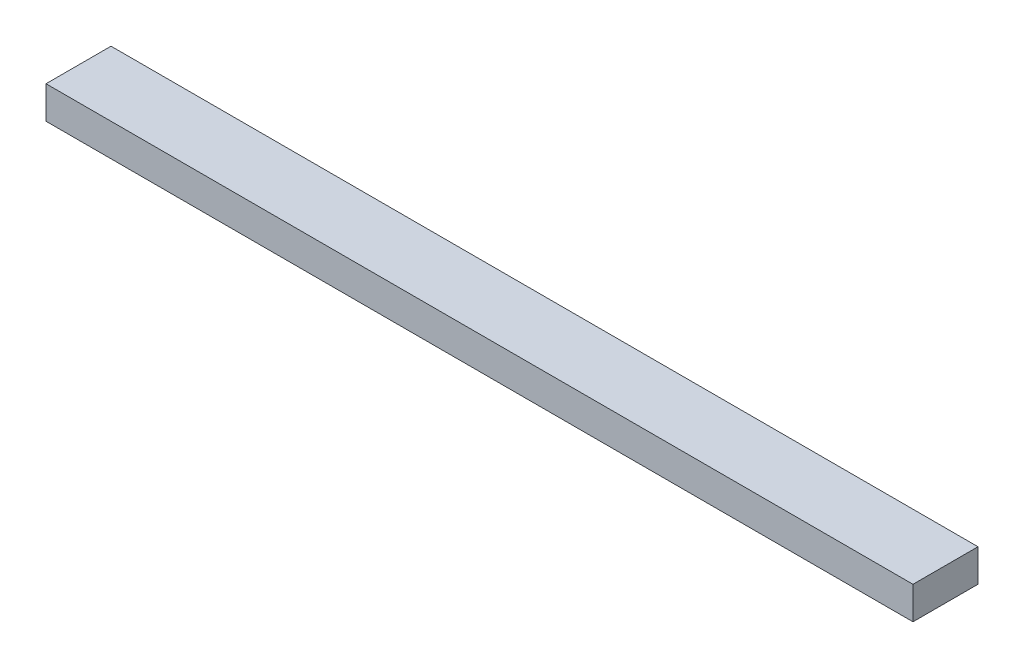
from build123d import *

# Parameters (mm, degrees)
SKETCH1_W           = 160
SKETCH1_H           = 12
BOSS_EXTRUDE1_DEPTH = 6


with BuildPart() as part:
    # Sketch1 → Boss-Extrude1 (new body)
    with BuildSketch(Plane(origin=(0, 0, 0), x_dir=(1, 0, 0), z_dir=(0, 1, 0))):
        Rectangle(SKETCH1_W, SKETCH1_H)
    extrude(amount=BOSS_EXTRUDE1_DEPTH)


solid = part.part
